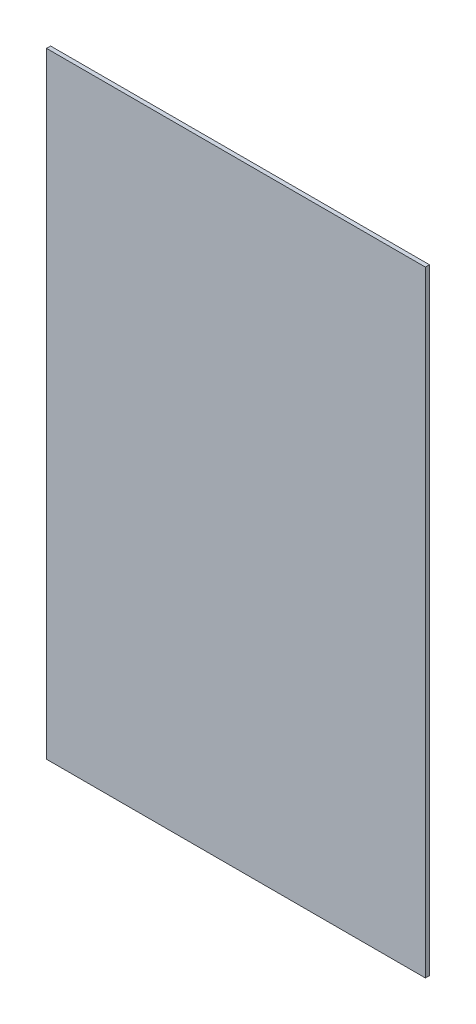
from build123d import *

# Parameters (mm, degrees)
SKETCH1_W           = 1760
SKETCH1_H           = 2860
BOSS_EXTRUDE1_DEPTH = 19


with BuildPart() as part:
    # Sketch1 → Boss-Extrude1 (new body)
    with BuildSketch(Plane.XY):
        with Locations((-2041.232429712, 29.552372351)):
            Rectangle(SKETCH1_W, SKETCH1_H)
    extrude(amount=BOSS_EXTRUDE1_DEPTH)


solid = part.part
